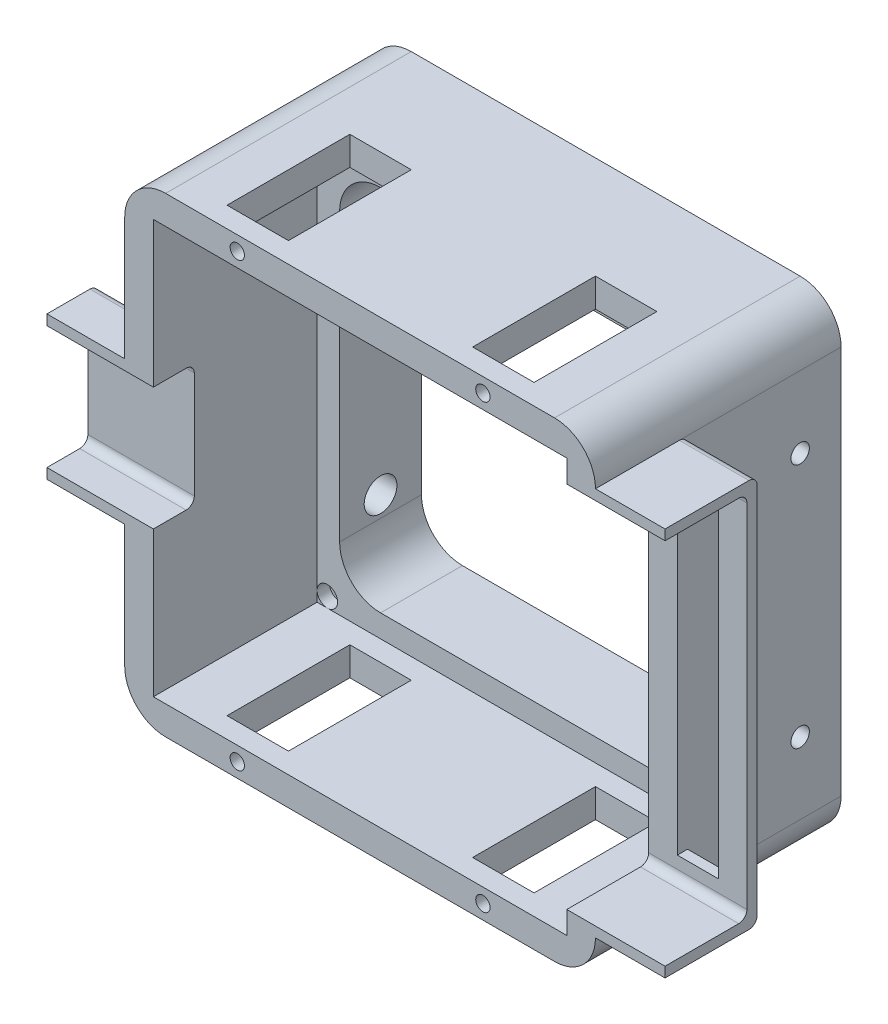
from build123d import *

# Parameters (mm, degrees)
SKETCH1_W                                  = 115
SKETCH1_H                                  = 115
BOSS_EXTRUDE1_DEPTH                        = 40
FILLET1_R                                  = 10
SKETCH4_W                                  = 101
SKETCH4_H                                  = 101
CUT_EXTRUDE3_DEPTH                         = 40
SKETCH7_W                                  = 90
SKETCH7_H                                  = 90
CUT_EXTRUDE5_DEPTH                         = 60
FILLET3_R                                  = 10
SKETCH8_R                                  = 3.15
CUT_EXTRUDE6_DEPTH                         = 35
MIRROR2_AT_THE_SECOND_PLANE_COPY_1_SKETC_R = 3.15
MIRROR2_AT_THE_SECOND_PLANE_COPY_1_DEPTH   = 35
SKETCH9_R                                  = 1.25
CUT_EXTRUDE7_DEPTH                         = 15
MIRROR3_AT_THE_SECOND_PLANE_COPY_1_SKETC_R = 1.25
MIRROR3_AT_THE_SECOND_PLANE_COPY_1_DEPTH   = 15
SKETCH10_R                                 = 2.5
CUT_EXTRUDE8_DEPTH                         = 3
MIRROR4_AT_THE_SECOND_PLANE_COPY_1_SKETC_R = 2.5
MIRROR4_AT_THE_SECOND_PLANE_COPY_1_DEPTH   = 3
SKETCH11_W                                 = 40
SKETCH11_H                                 = 90
CUT_EXTRUDE9_DEPTH                         = 11
SKETCH13_W                                 = 2.5
SKETCH13_H                                 = 90
BOSS_EXTRUDE2_DEPTH                        = 17
FILLET6_R                                  = 2
SKETCH14_W                                 = 20
SKETCH14_H                                 = 30
CUT_EXTRUDE10_DEPTH                        = 11
SKETCH15_W                                 = 10
SKETCH15_H                                 = 2.5
BOSS_EXTRUDE3_DEPTH                        = 19
FILLET7_R                                  = 2
SKETCH16_W                                 = 115
SKETCH16_H                                 = 115
CUT_EXTRUDE12_DEPTH                        = 20
SKETCH17_W                                 = 10
SKETCH17_H                                 = 80
CUT_EXTRUDE13_DEPTH                        = 15
SKETCH20_R                                 = 2.25
CUT_EXTRUDE14_DEPTH                        = 25
MIRROR8_AT_THE_SECOND_PLANE_COPY_1_SKETC_R = 2.25
MIRROR8_AT_THE_SECOND_PLANE_COPY_1_DEPTH   = 25
SKETCH21_R                                 = 1.75
CUT_EXTRUDE15_DEPTH                        = 20
MIRROR9_AT_THE_SECOND_PLANE_COPY_1_SKETC_R = 1.75
MIRROR9_AT_THE_SECOND_PLANE_COPY_1_DEPTH   = 20
SKETCH24_W                                 = 15
SKETCH24_H                                 = 30
CUT_EXTRUDE16_DEPTH                        = 10
MIRROR10_AT_THE_SECOND_PLANE_COPY_1_SKET_W = 15
MIRROR10_AT_THE_SECOND_PLANE_COPY_1_SKET_H = 30
MIRROR10_AT_THE_SECOND_PLANE_COPY_1_DEPTH  = 10
SKETCH25_R                                 = 4
CUT_EXTRUDE17_DEPTH                        = 7.5
MIRROR11_AT_THE_SECOND_PLANE_COPY_1_SKET_R = 4
MIRROR11_AT_THE_SECOND_PLANE_COPY_1_DEPTH  = 7.5


with BuildPart() as part:
    # Sketch1 → Boss-Extrude1 (new, symmetric)
    with BuildSketch(Plane.XY):
        Rectangle(SKETCH1_W, SKETCH1_H)
    extrude(amount=BOSS_EXTRUDE1_DEPTH, both=True)

    # Fillet1
    fillet1_edges = [part.edges().sort_by_distance(p)[0] for p in [
        (-57.5, 57.5, 0),
        (57.5, 57.5, 0),
        (57.5, -57.5, 0),
        (-57.5, -57.5, 0),
    ]]
    fillet(fillet1_edges, radius=FILLET1_R)

    # Sketch4 → Cut-Extrude3 (cut)
    with BuildSketch(Plane.XY.offset(40)):
        Rectangle(SKETCH4_W, SKETCH4_H)
    extrude(amount=-CUT_EXTRUDE3_DEPTH, mode=Mode.SUBTRACT)

    # Sketch7 → Cut-Extrude5 (cut)
    with BuildSketch(Plane.XY):
        Rectangle(SKETCH7_W, SKETCH7_H)
    extrude(amount=-CUT_EXTRUDE5_DEPTH, mode=Mode.SUBTRACT)

    # Fillet3
    fillet3_edges = [part.edges().sort_by_distance(p)[0] for p in [
        (-45, -45, -20),
        (-45, 45, -20),
        (45, 45, -20),
        (45, -45, -20),
    ]]
    fillet(fillet3_edges, radius=FILLET3_R)

    # Sketch8 → Cut-Extrude6 (cut)
    with BuildSketch(Plane(origin=(0, 0, -40), x_dir=(-1, 0, 0), z_dir=(0, 0, -1))):
        with Locations((-48, 48)):
            Circle(SKETCH8_R)
    cut_extrude6 = extrude(amount=-CUT_EXTRUDE6_DEPTH, mode=Mode.SUBTRACT)

    # Mirror2: Cut-Extrude6 across plane
    add(cut_extrude6.mirror(Plane.ZX), mode=Mode.SUBTRACT)

    # Mirror2 at the second plane: Cut-Extrude6 across plane
    add(cut_extrude6.mirror(Plane(origin=(0, 0, 0), x_dir=(0, 0, 1), z_dir=(1, 0, 0))), mode=Mode.SUBTRACT)

    # Mirror2 at the second plane copy 1 sketc → Mirror2 at the second plane copy 1 (cut)
    with BuildSketch(Plane(origin=(0, 0, -40), x_dir=(1, 0, 0), z_dir=(0, 0, -1))):
        with Locations((-48, 48)):
            Circle(MIRROR2_AT_THE_SECOND_PLANE_COPY_1_SKETC_R)
    extrude(amount=-MIRROR2_AT_THE_SECOND_PLANE_COPY_1_DEPTH, mode=Mode.SUBTRACT)

    # Sketch9 → Cut-Extrude7 (cut)
    with BuildSketch(Plane.XY):
        with Locations((-48, 48)):
            Circle(SKETCH9_R)
    cut_extrude7 = extrude(amount=-CUT_EXTRUDE7_DEPTH, mode=Mode.SUBTRACT)

    # Mirror3: Cut-Extrude7 across plane
    add(cut_extrude7.mirror(Plane.ZX), mode=Mode.SUBTRACT)

    # Mirror3 at the second plane: Cut-Extrude7 across plane
    add(cut_extrude7.mirror(Plane(origin=(0, 0, 0), x_dir=(0, 0, 1), z_dir=(1, 0, 0))), mode=Mode.SUBTRACT)

    # Mirror3 at the second plane copy 1 sketc → Mirror3 at the second plane copy 1 (cut)
    with BuildSketch(Plane(origin=(0, 0, 0), x_dir=(-1, 0, 0), z_dir=(0, 0, 1))):
        with Locations((-48, 48)):
            Circle(MIRROR3_AT_THE_SECOND_PLANE_COPY_1_SKETC_R)
    extrude(amount=-MIRROR3_AT_THE_SECOND_PLANE_COPY_1_DEPTH, mode=Mode.SUBTRACT)

    # Sketch10 → Cut-Extrude8 (cut)
    with BuildSketch(Plane.XY):
        with Locations((-48, 48)):
            Circle(SKETCH10_R)
    cut_extrude8 = extrude(amount=-CUT_EXTRUDE8_DEPTH, mode=Mode.SUBTRACT)

    # Mirror4: Cut-Extrude8 across plane
    add(cut_extrude8.mirror(Plane.ZX), mode=Mode.SUBTRACT)

    # Mirror4 at the second plane: Cut-Extrude8 across plane
    add(cut_extrude8.mirror(Plane(origin=(0, 0, 0), x_dir=(0, 0, 1), z_dir=(1, 0, 0))), mode=Mode.SUBTRACT)

    # Mirror4 at the second plane copy 1 sketc → Mirror4 at the second plane copy 1 (cut)
    with BuildSketch(Plane(origin=(0, 0, 0), x_dir=(-1, 0, 0), z_dir=(0, 0, 1))):
        with Locations((-48, 48)):
            Circle(MIRROR4_AT_THE_SECOND_PLANE_COPY_1_SKETC_R)
    extrude(amount=-MIRROR4_AT_THE_SECOND_PLANE_COPY_1_DEPTH, mode=Mode.SUBTRACT)

    # Sketch11 → Cut-Extrude9 (cut)
    with BuildSketch(Plane(origin=(57.5, 0, 0), x_dir=(0, 0, -1), z_dir=(1, 0, 0))):
        with Locations((-40, 0)):
            Rectangle(SKETCH11_W, SKETCH11_H)
    extrude(amount=-CUT_EXTRUDE9_DEPTH, mode=Mode.SUBTRACT)

    # Sketch13 → Boss-Extrude2 (add)
    with BuildSketch(Plane(origin=(57.5, 0, 0), x_dir=(0, 0, -1), z_dir=(1, 0, 0))):
        with Locations((-18.75, 0)):
            Rectangle(SKETCH13_W, SKETCH13_H)
        Polygon((-17.5, -45), (-20, -45), (-40, -45), (-40, -47.5), (-17.5, -47.5), align=None)
        Polygon((-40, 45), (-20, 45), (-17.5, 45), (-17.5, 47.5), (-40, 47.5), align=None)
    extrude(amount=BOSS_EXTRUDE2_DEPTH)

    # Fillet6
    fillet6_edges = [part.edges().sort_by_distance(p)[0] for p in [
        (62.5, 45, 20),
        (62.5, -45, 20),
        (66, -47.5, 17.5),
        (66, 47.5, 17.5),
    ]]
    fillet(fillet6_edges, radius=FILLET6_R)

    # Sketch14 → Cut-Extrude10 (cut)
    with BuildSketch(Plane.ZY.offset(57.5)):
        with Locations((40, 0)):
            Rectangle(SKETCH14_W, SKETCH14_H)
    extrude(amount=-CUT_EXTRUDE10_DEPTH, mode=Mode.SUBTRACT)

    # Sketch15 → Boss-Extrude3 (add)
    with BuildSketch(Plane.ZY.offset(57.5)):
        Polygon((30, -15), (30, 15), (30, 17.5), (27.5, 17.5), (27.5, -17.5), (30, -17.5), align=None)
        with Locations((35, 16.25)):
            Rectangle(SKETCH15_W, SKETCH15_H)
        with Locations((35, -16.25)):
            Rectangle(SKETCH15_W, SKETCH15_H)
    extrude(amount=BOSS_EXTRUDE3_DEPTH)

    # Fillet7
    fillet7_edges = [part.edges().sort_by_distance(p)[0] for p in [
        (-63.5, -15, 30),
        (-63.5, 15, 30),
        (-67, 17.5, 27.5),
        (-67, -17.5, 27.5),
    ]]
    fillet(fillet7_edges, radius=FILLET7_R)

    # Sketch16 → Cut-Extrude12 (cut)
    with BuildSketch(Plane(origin=(0, 0, -40), x_dir=(-1, 0, 0), z_dir=(0, 0, -1))):
        Rectangle(SKETCH16_W, SKETCH16_H)
    extrude(amount=-CUT_EXTRUDE12_DEPTH, mode=Mode.SUBTRACT)

    # Sketch17 → Cut-Extrude13 (cut)
    with BuildSketch(Plane(origin=(0, 0, 17.5), x_dir=(-1, 0, 0), z_dir=(0, 0, -1))):
        with Locations((-62.5, 0)):
            Rectangle(SKETCH17_W, SKETCH17_H)
    extrude(amount=-CUT_EXTRUDE13_DEPTH, mode=Mode.SUBTRACT)

    # Sketch20 → Cut-Extrude14 (cut)
    with BuildSketch(Plane(origin=(57.5, 0, 0), x_dir=(0, 0, -1), z_dir=(1, 0, 0))):
        with Locations((10, 30)):
            Circle(SKETCH20_R)
    cut_extrude14 = extrude(amount=-CUT_EXTRUDE14_DEPTH, mode=Mode.SUBTRACT)

    # Mirror8: Cut-Extrude14 across plane
    add(cut_extrude14.mirror(Plane(origin=(0, 0, 0), x_dir=(0, 0, 1), z_dir=(1, 0, 0))), mode=Mode.SUBTRACT)

    # Mirror8 at the second plane: Cut-Extrude14 across plane
    add(cut_extrude14.mirror(Plane.ZX), mode=Mode.SUBTRACT)

    # Mirror8 at the second plane copy 1 sketc → Mirror8 at the second plane copy 1 (cut)
    with BuildSketch(Plane(origin=(-57.5, 0, 0), x_dir=(0, 0, -1), z_dir=(-1, 0, 0))):
        with Locations((10, 30)):
            Circle(MIRROR8_AT_THE_SECOND_PLANE_COPY_1_SKETC_R)
    extrude(amount=-MIRROR8_AT_THE_SECOND_PLANE_COPY_1_DEPTH, mode=Mode.SUBTRACT)

    # Sketch21 → Cut-Extrude15 (cut)
    with BuildSketch(Plane.XY.offset(40)):
        with Locations((30, 54)):
            Circle(SKETCH21_R)
    cut_extrude15 = extrude(amount=-CUT_EXTRUDE15_DEPTH, mode=Mode.SUBTRACT)

    # Mirror9: Cut-Extrude15 across plane
    add(cut_extrude15.mirror(Plane.ZX), mode=Mode.SUBTRACT)

    # Mirror9 at the second plane: Cut-Extrude15 across plane
    add(cut_extrude15.mirror(Plane(origin=(0, 0, 0), x_dir=(0, 0, 1), z_dir=(1, 0, 0))), mode=Mode.SUBTRACT)

    # Mirror9 at the second plane copy 1 sketc → Mirror9 at the second plane copy 1 (cut)
    with BuildSketch(Plane(origin=(0, 0, 40), x_dir=(-1, 0, 0), z_dir=(0, 0, 1))):
        with Locations((30, 54)):
            Circle(MIRROR9_AT_THE_SECOND_PLANE_COPY_1_SKETC_R)
    extrude(amount=-MIRROR9_AT_THE_SECOND_PLANE_COPY_1_DEPTH, mode=Mode.SUBTRACT)

    # Sketch24 → Cut-Extrude16 (cut)
    with BuildSketch(Plane(origin=(0, 57.5, 0), x_dir=(1, 0, 0), z_dir=(0, 1, 0))):
        with Locations((30, -20)):
            Rectangle(SKETCH24_W, SKETCH24_H)
    cut_extrude16 = extrude(amount=-CUT_EXTRUDE16_DEPTH, mode=Mode.SUBTRACT)

    # Mirror10: Cut-Extrude16 across plane
    add(cut_extrude16.mirror(Plane(origin=(0, 0, 0), x_dir=(0, 0, 1), z_dir=(1, 0, 0))), mode=Mode.SUBTRACT)

    # Mirror10 at the second plane: Cut-Extrude16 across plane
    add(cut_extrude16.mirror(Plane.ZX), mode=Mode.SUBTRACT)

    # Mirror10 at the second plane copy 1 sket → Mirror10 at the second plane copy 1 (cut)
    with BuildSketch(Plane(origin=(0, -57.5, 0), x_dir=(-1, 0, 0), z_dir=(0, -1, 0))):
        with Locations((30, -20)):
            Rectangle(MIRROR10_AT_THE_SECOND_PLANE_COPY_1_SKET_W, MIRROR10_AT_THE_SECOND_PLANE_COPY_1_SKET_H)
    extrude(amount=-MIRROR10_AT_THE_SECOND_PLANE_COPY_1_DEPTH, mode=Mode.SUBTRACT)

    # Sketch25 → Cut-Extrude17 (cut)
    with BuildSketch(Plane.ZY.offset(-45)):
        with Locations((-10, 30)):
            Circle(SKETCH25_R)
    cut_extrude17 = extrude(amount=-CUT_EXTRUDE17_DEPTH, mode=Mode.SUBTRACT)

    # Mirror11: Cut-Extrude17 across plane
    add(cut_extrude17.mirror(Plane.ZX), mode=Mode.SUBTRACT)

    # Mirror11 at the second plane: Cut-Extrude17 across plane
    add(cut_extrude17.mirror(Plane(origin=(0, 0, 0), x_dir=(0, 0, 1), z_dir=(1, 0, 0))), mode=Mode.SUBTRACT)

    # Mirror11 at the second plane copy 1 sket → Mirror11 at the second plane copy 1 (cut)
    with BuildSketch(Plane(origin=(-45, 0, 0), x_dir=(0, 0, 1), z_dir=(1, 0, 0))):
        with Locations((-10, 30)):
            Circle(MIRROR11_AT_THE_SECOND_PLANE_COPY_1_SKET_R)
    extrude(amount=-MIRROR11_AT_THE_SECOND_PLANE_COPY_1_DEPTH, mode=Mode.SUBTRACT)


solid = part.part
